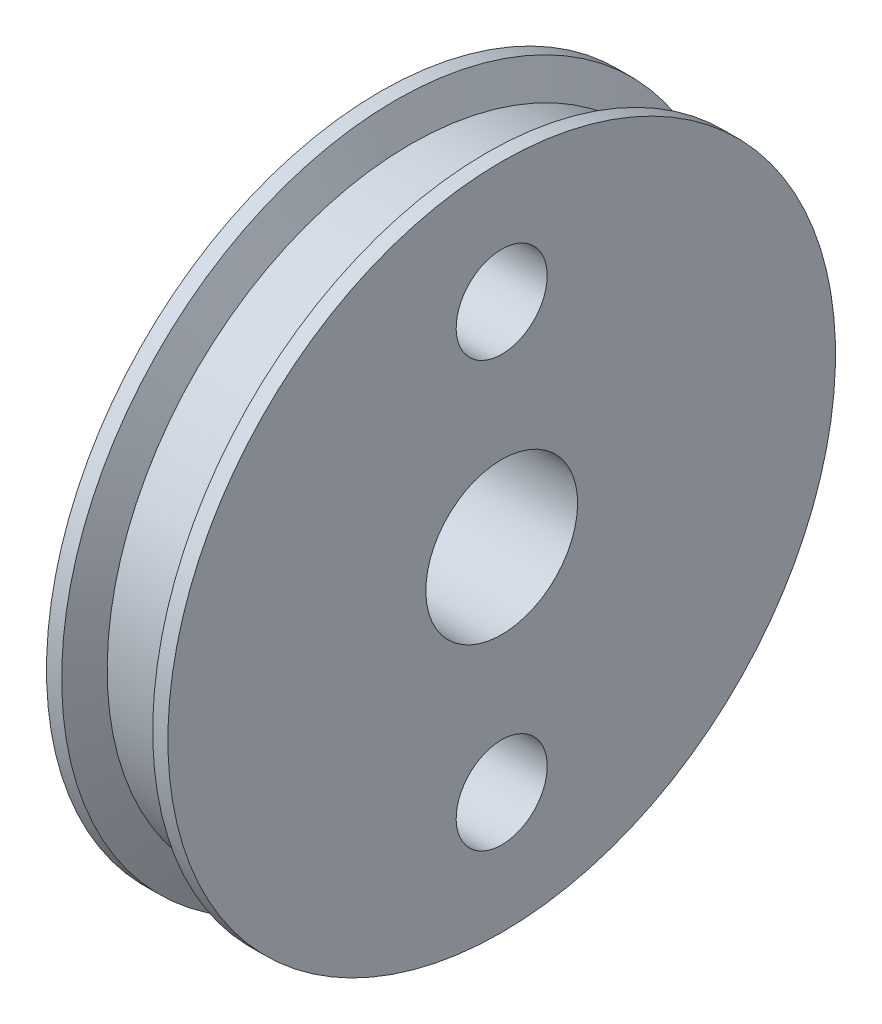
from build123d import *

# Parameters (mm, degrees)
ESQUISSE2_R             = 2.5
ESQUISSE2_R_2           = 1.5
ENL_V_MAT_EXTRU_1_DEPTH = 10


with BuildPart() as part:
    # Esquisse1 → Révolution1 (revolve)
    with BuildSketch(Plane.XY):
        Polygon((0, 0), (0, 11), (0.5, 11), (1, 10), (3, 10), (3.5, 11), (4, 11), (4, 0), align=None)
    revolve(axis=Axis((4, 0, 0), (-1, 0, 0)))

    # Esquisse2 → Enlèv. mat.-Extru.1 (cut)
    with BuildSketch(Plane(origin=(4, 0, 0), x_dir=(0, 0, -1), z_dir=(1, 0, 0))):
        with Locations(Location((0, 0, 0), (0, 0, 90))):
            Circle(ESQUISSE2_R)
        with Locations(Location((0, 7, 0), (0, 0, 90))):
            Circle(ESQUISSE2_R_2)
        with Locations(Location((0, -7, 0), (0, 0, 90))):
            Circle(ESQUISSE2_R_2)
    extrude(amount=-ENL_V_MAT_EXTRU_1_DEPTH, mode=Mode.SUBTRACT)


solid = part.part
